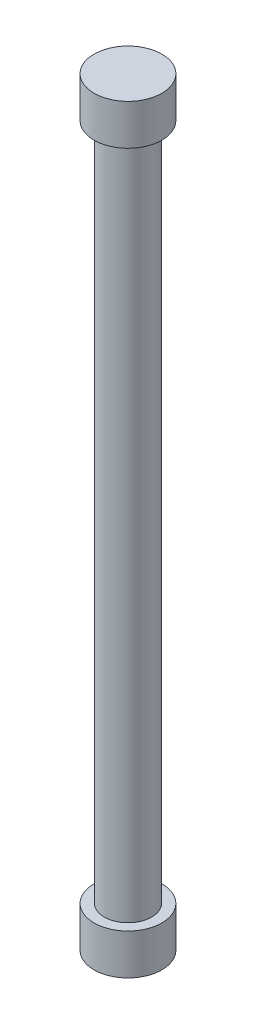
from build123d import *

# Parameters (mm, degrees)
SKETCH2_R           = 2.5
BOSS_EXTRUDE1_DEPTH = 3
SKETCH3_R           = 1.75
BOSS_EXTRUDE2_DEPTH = 50
SKETCH4_R           = 2.5
BOSS_EXTRUDE3_DEPTH = 3


with BuildPart() as part:
    # Sketch2 → Boss-Extrude1 (new body)
    with BuildSketch(Plane(origin=(0, 0, 0), x_dir=(1, 0, 0), z_dir=(0, 1, 0))):
        with Locations(Location((0, 0, 0), (0, 0, 270))):
            Circle(SKETCH2_R)
    extrude(amount=BOSS_EXTRUDE1_DEPTH)

    # Sketch3 → Boss-Extrude2 (add)
    with BuildSketch(Plane(origin=(0, 3, 0), x_dir=(1, 0, 0), z_dir=(0, 1, 0))):
        with Locations(Location((0, 0, 0), (0, 0, 270))):
            Circle(SKETCH3_R)
    extrude(amount=BOSS_EXTRUDE2_DEPTH)

    # Sketch4 → Boss-Extrude3 (add)
    with BuildSketch(Plane(origin=(0, 53, 0), x_dir=(1, 0, 0), z_dir=(0, 1, 0))):
        with Locations(Location((0, 0, 0), (0, 0, 270))):
            Circle(SKETCH4_R)
    extrude(amount=BOSS_EXTRUDE3_DEPTH)


solid = part.part
